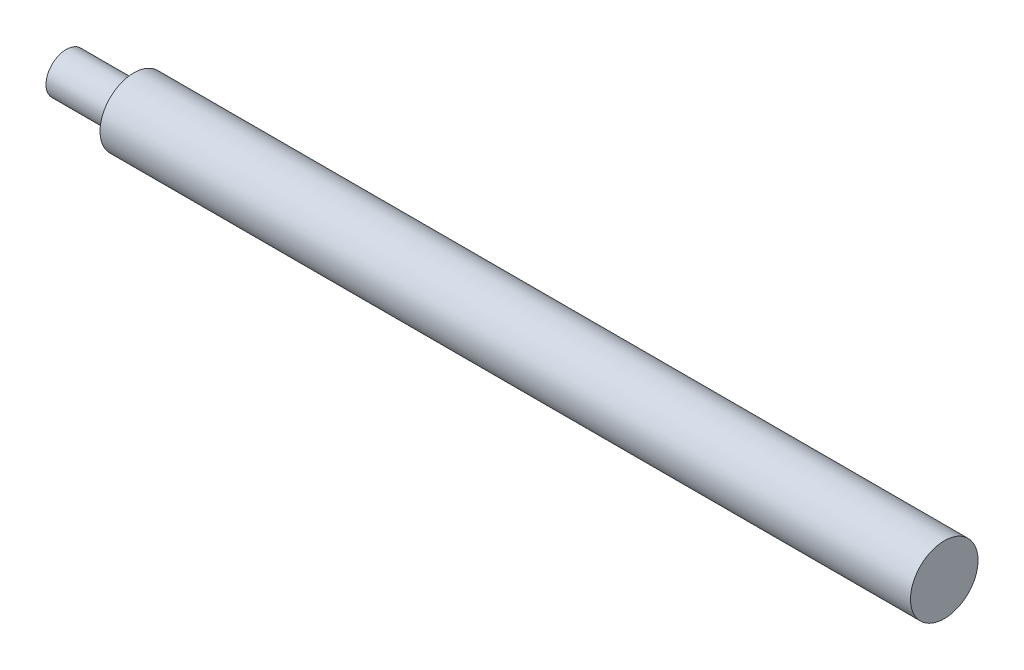
from build123d import *


with BuildPart() as part:
    # Esquisse1 → Révolution1 (revolve)
    with BuildSketch(Plane.XY, mode=Mode.PRIVATE) as r_volution1_sk:
        Polygon((-55.292077871, 0), (74.707922129, 0), (74.707922129, 5), (-45.292077871, 5), (-45.292077871, 3), (-55.292077871, 3), align=None)
    revolve(r_volution1_sk.sketch.rotate(Axis((-55.292077871, 0, 0), (1, 0, 0)), 90), axis=Axis((-55.292077871, 0, 0), (1, 0, 0)))


solid = part.part
